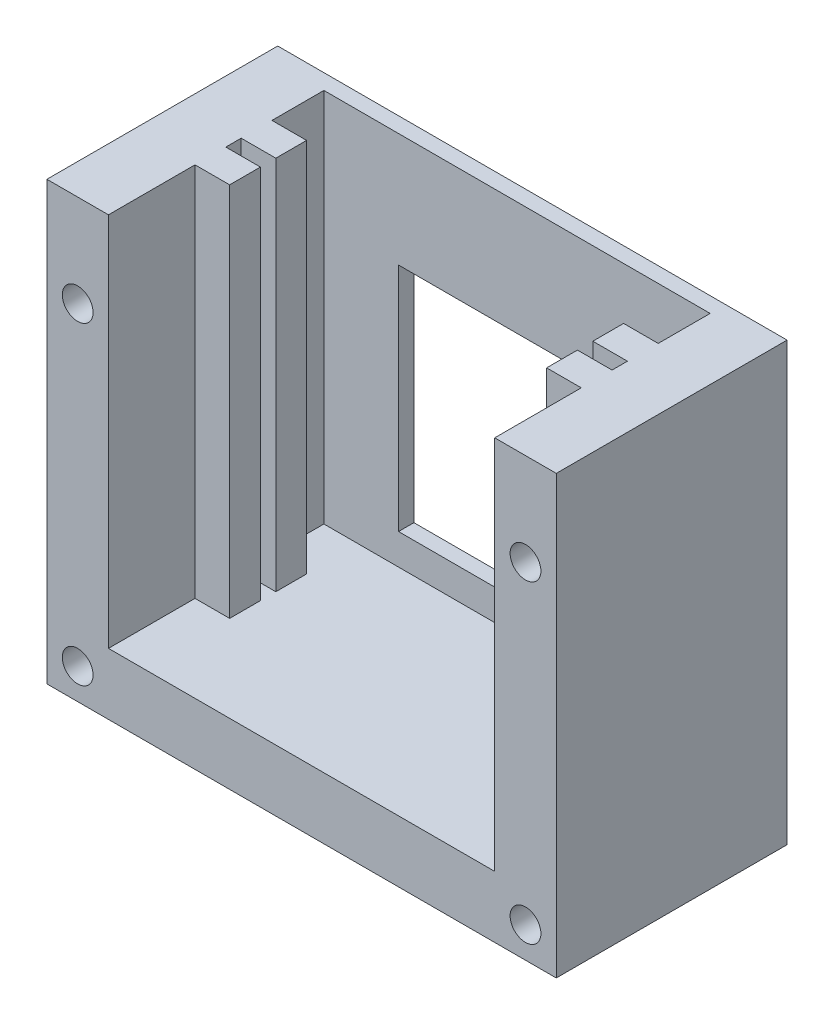
from build123d import *

# Parameters (mm, degrees)
ESQUISSE1_R             = 37
ESQUISSE1_R_2           = 1.5
ESQUISSE1_W             = 25
ESQUISSE1_H             = 3
BOSS_EXTRU_1_DEPTH      = 2
BOSS_EXTRU_2_DEPTH      = 15
ESQUISSE3_W             = 2
ESQUISSE3_H             = 28.4
BOSS_EXTRU_3_DEPTH      = 2.25
ESQUISSE5_W             = 2
ESQUISSE5_H             = 24.4
BOSS_EXTRU_4_DEPTH      = 2.25
ESQUISSE7_W             = 33.1
ESQUISSE7_H             = 28.4
BOSS_EXTRU_5_DEPTH      = 1
ESQUISSE8_W             = 15
ESQUISSE8_H             = 15
ENL_V_MAT_EXTRU_1_DEPTH = 3
ESQUISSE9_W             = 21
ESQUISSE9_H             = 2.5
ENL_V_MAT_EXTRU_2_DEPTH = 3
ESQUISSE10_R            = 1
ENL_V_MAT_EXTRU_3_DEPTH = 19
ENL_V_START             = -2
ESQUISSE11_R            = 37
ENL_V_MAT_EXTRU_4_DEPTH = 2


with BuildPart() as part:
    # Esquisse1 → Boss.-Extru.1 (new body)
    with BuildSketch(Plane.XY):
        Circle(ESQUISSE1_R)
        with Locations((0, 30)):
            Circle(ESQUISSE1_R_2, mode=Mode.SUBTRACT)
        with Locations((-22.874807889, 14.34375)):
            Circle(ESQUISSE1_R_2, mode=Mode.SUBTRACT)
        with Locations((-25.416453209, -15.9375)):
            Circle(ESQUISSE1_R_2, mode=Mode.SUBTRACT)
        with Locations((0, -27)):
            Circle(ESQUISSE1_R_2, mode=Mode.SUBTRACT)
        with Locations((25.416453209, -15.9375)):
            Circle(ESQUISSE1_R_2, mode=Mode.SUBTRACT)
        with Locations((22.874807889, 14.34375)):
            Circle(ESQUISSE1_R_2, mode=Mode.SUBTRACT)
        with Locations((0, -15.5)):
            Rectangle(ESQUISSE1_W, ESQUISSE1_H, mode=Mode.SUBTRACT)
    extrude(amount=BOSS_EXTRU_1_DEPTH)

    # Esquisse2 → Boss.-Extru.2 (add)
    with BuildSketch(Plane(origin=(0, 0, 0), x_dir=(-1, 0, 0), z_dir=(0, 0, -1))):
        Polygon((-16.75, 14.9), (-12.75, 14.9), (-12.75, -9.5), (12.35, -9.5), (12.35, 14.9), (16.35, 14.9), (16.35, -13.5), (-16.75, -13.5), align=None)
    extrude(amount=BOSS_EXTRU_2_DEPTH)

    # Esquisse3 → Boss.-Extru.3 (add)
    with BuildSketch(Plane(origin=(-12.35, 0, 0), x_dir=(0, 0, -1), z_dir=(1, 0, 0))):
        with Locations((9.625, 0.7)):
            Rectangle(ESQUISSE3_W, ESQUISSE3_H)
        with Locations((6.625, 0.7)):
            Rectangle(ESQUISSE3_W, ESQUISSE3_H)
    extrude(amount=BOSS_EXTRU_3_DEPTH)

    # Esquisse5 → Boss.-Extru.4 (add)
    with BuildSketch(Plane.ZY.offset(-12.75)):
        with Locations((-9.625, 2.7)):
            Rectangle(ESQUISSE5_W, ESQUISSE5_H)
        with Locations((-6.625, 2.7)):
            Rectangle(ESQUISSE5_W, ESQUISSE5_H)
    extrude(amount=BOSS_EXTRU_4_DEPTH)

    # Esquisse7 → Boss.-Extru.5 (add)
    with BuildSketch(Plane(origin=(0, 0, -15), x_dir=(-1, 0, 0), z_dir=(0, 0, -1))):
        with Locations((-0.2, 0.7)):
            Rectangle(ESQUISSE7_W, ESQUISSE7_H)
    extrude(amount=-BOSS_EXTRU_5_DEPTH)

    # Esquisse8 → Enlèv. mat.-Extru.1 (cut)
    with BuildSketch(Plane(origin=(0, 0, -15), x_dir=(-1, 0, 0), z_dir=(0, 0, -1))):
        Rectangle(ESQUISSE8_W, ESQUISSE8_H)
    extrude(amount=-ENL_V_MAT_EXTRU_1_DEPTH, mode=Mode.SUBTRACT)

    # Esquisse9 → Enlèv. mat.-Extru.2 (cut)
    with BuildSketch(Plane.XZ.offset(13.5)):
        with Locations((0, -5.65)):
            Rectangle(ESQUISSE9_W, ESQUISSE9_H)
    extrude(amount=-ENL_V_MAT_EXTRU_2_DEPTH, mode=Mode.SUBTRACT)

    # Esquisse10 → Enlèv. mat.-Extru.3 (cut)
    with BuildSketch(Plane.XY.offset(2)):
        with Locations((-14.35, 8.9)):
            Circle(ESQUISSE10_R)
        with Locations((-14.35, -11.5)):
            Circle(ESQUISSE10_R)
        with Locations((14.75, -11.5)):
            Circle(ESQUISSE10_R)
        with Locations((14.75, 8.9)):
            Circle(ESQUISSE10_R)
    extrude(amount=-ENL_V_MAT_EXTRU_3_DEPTH, mode=Mode.SUBTRACT)

    # Esquisse11 → Enlèv. mat.-Extru.4 (cut)
    with BuildSketch(Plane.XY.offset(2).offset(ENL_V_START)):
        Circle(ESQUISSE11_R)
    extrude(amount=ENL_V_MAT_EXTRU_4_DEPTH, mode=Mode.SUBTRACT)


solid = part.part
